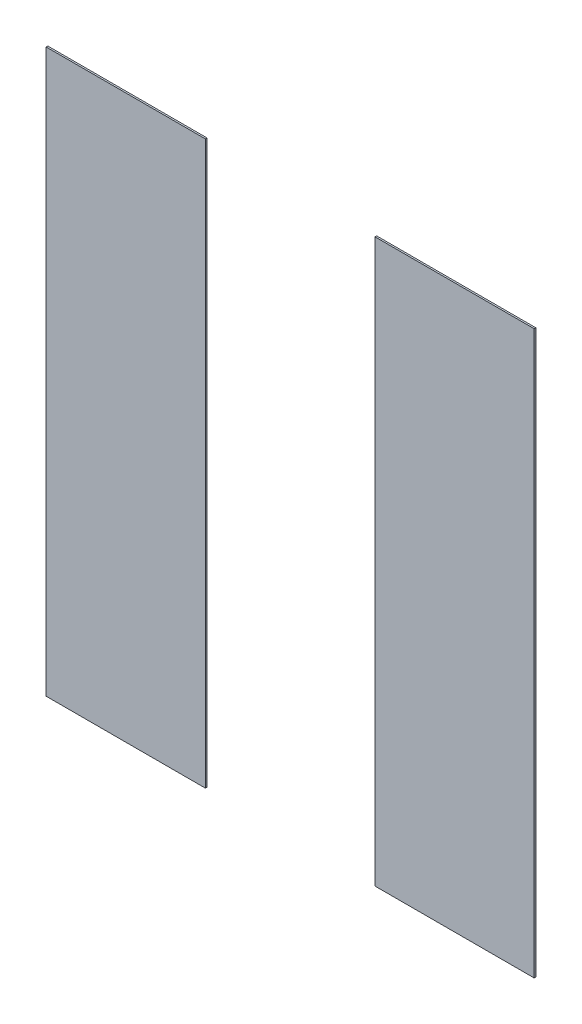
from build123d import *

# Parameters (mm, degrees)
SKETCH_1_W        = 1.905
SKETCH_1_H        = 6.731
EXTRUDE_1_DEPTH   = 0.02
EXTRUDE_1_2_DEPTH = 0.02


with BuildPart() as part:
    # 草图1 → 凸台-拉伸1 (new body)
    with BuildSketch(Plane.XY):
        with Locations((-1.9685, 0)):
            Rectangle(SKETCH_1_W, SKETCH_1_H)
    extrude(amount=EXTRUDE_1_DEPTH)


with BuildPart() as body_2:
    # 草图1 → Extrude 1 2 (new body)
    with BuildSketch(Plane.XY):
        with Locations((1.9685, 0)):
            Rectangle(SKETCH_1_W, SKETCH_1_H)
    extrude(amount=EXTRUDE_1_2_DEPTH)


solid = Compound([part.part, body_2.part])
